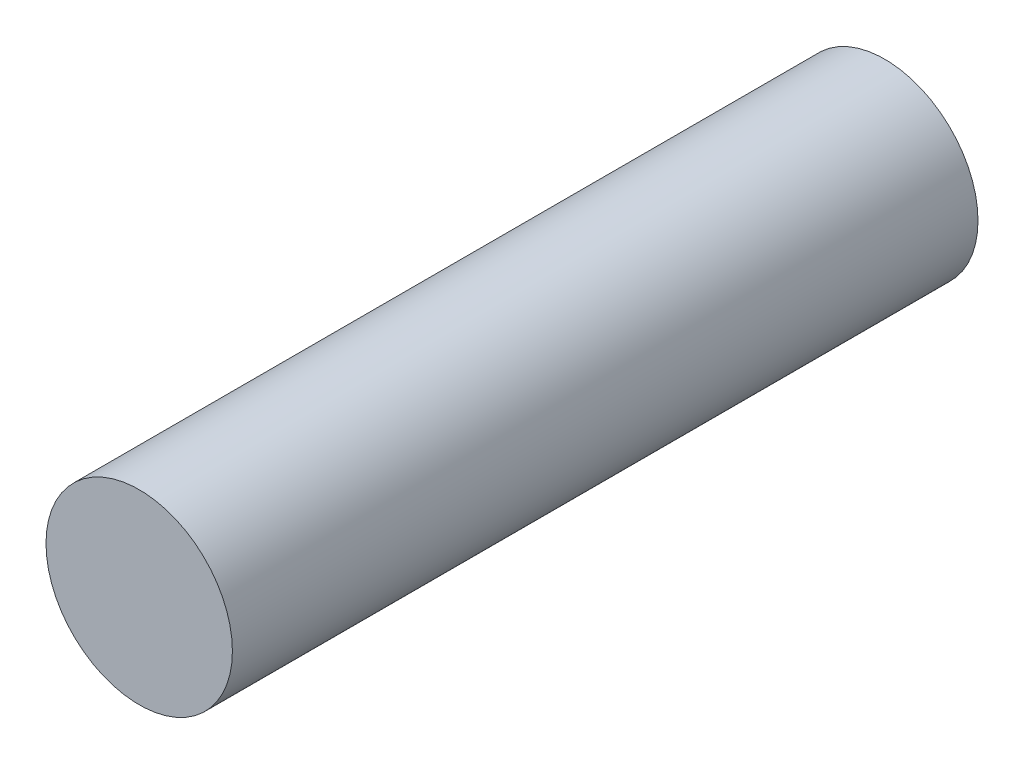
from build123d import *

# Parameters (mm, degrees)
SKETCH1_R           = 50
BOSS_EXTRUDE1_DEPTH = 200


with BuildPart() as part:
    # Sketch1 → Boss-Extrude1 (new, symmetric)
    with BuildSketch(Plane.XY):
        Circle(SKETCH1_R)
    extrude(amount=BOSS_EXTRUDE1_DEPTH, both=True)


solid = part.part
